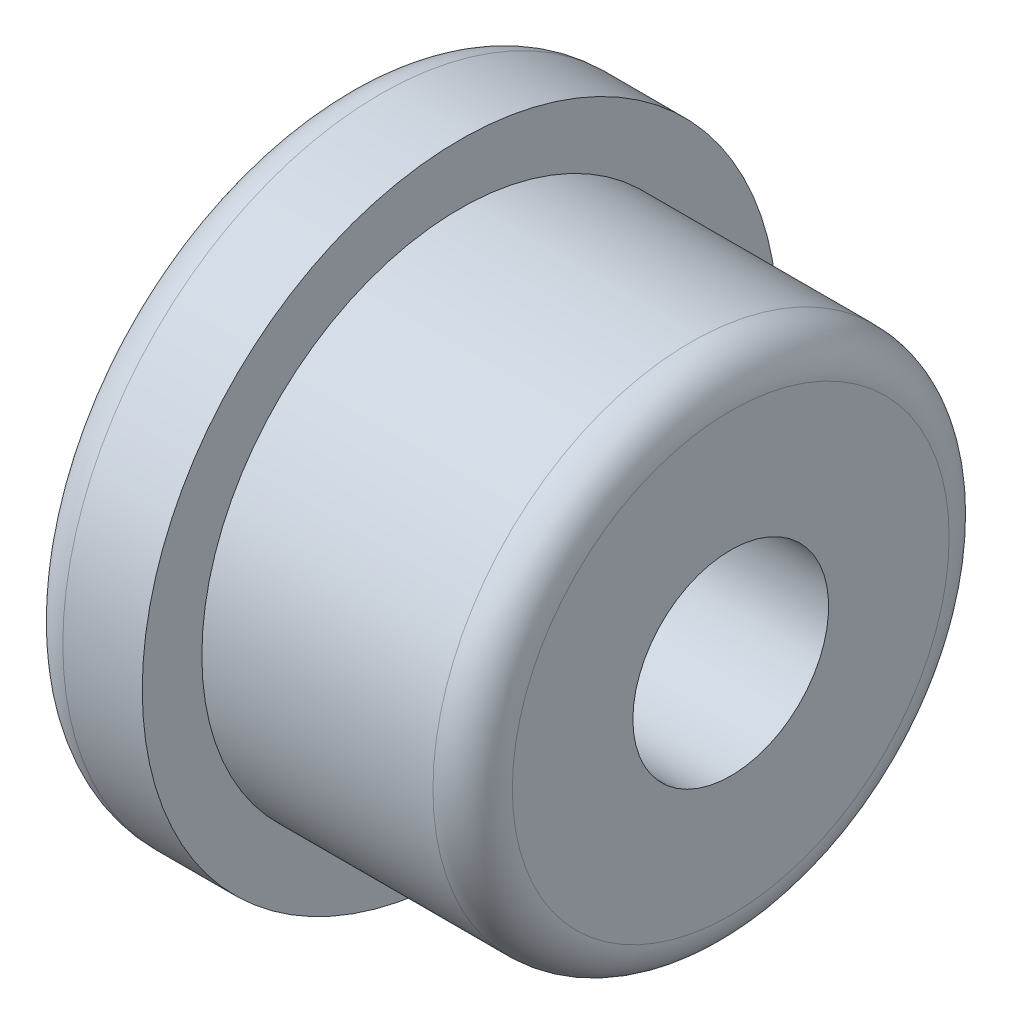
from build123d import *

# Parameters (mm, degrees)
REDONDEO1_R = 1


with BuildPart() as part:
    # Croquis1 → Revolución1 (revolve)
    with BuildSketch(Plane.XY, mode=Mode.PRIVATE) as revoluci_n1_sk:
        Polygon((0, 2.465), (9.82, 2.465), (9.82, 6.5), (3, 6.5), (3, 8), (0, 8), align=None)
    revolve(revoluci_n1_sk.sketch.rotate(Axis((0, 0, 0), (1, 0, 0)), 90), axis=Axis((0, 0, 0), (1, 0, 0)))

    # Redondeo1
    redondeo1_edges = [part.edges().sort_by_distance(p)[0] for p in [
        (0, 0, -8),
        (9.82, 0, -6.5),
    ]]
    fillet(redondeo1_edges, radius=REDONDEO1_R)


solid = part.part
